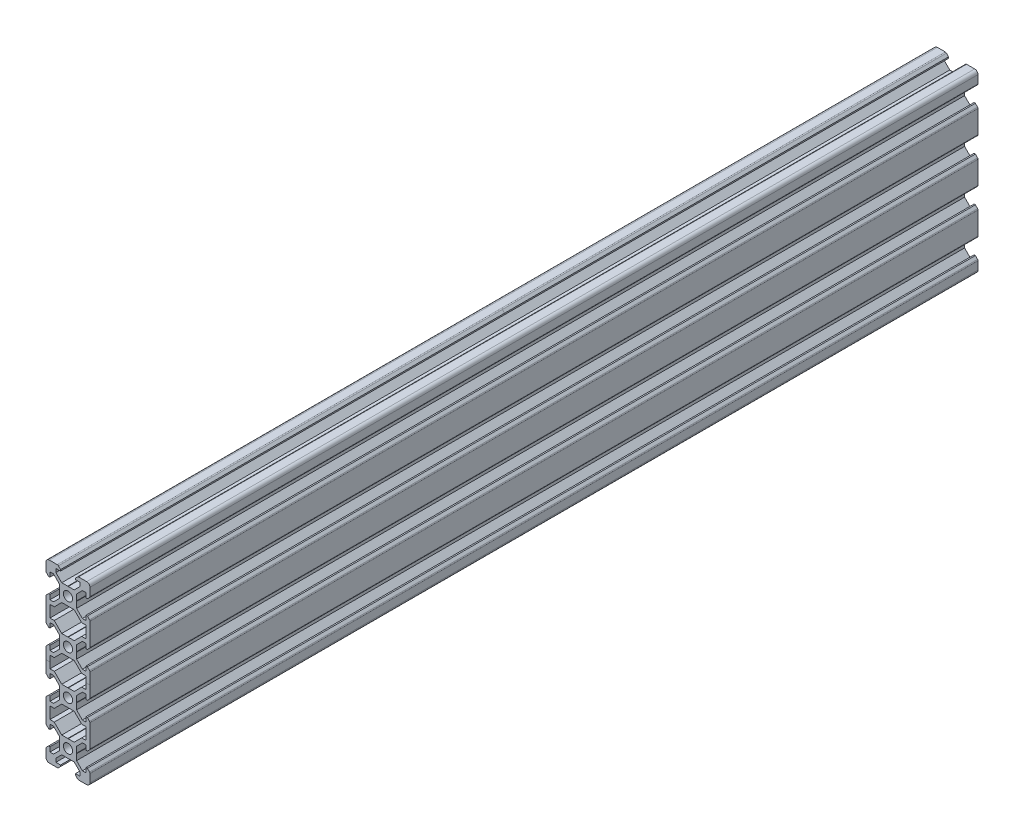
from build123d import *

# Parameters (mm, degrees)
SKETCH1_R           = 2.1
BOSS_EXTRUDE2_DEPTH = 404


with BuildPart() as part:
    # Sketch1 → Boss-Extrude2 (new body)
    with BuildSketch(Plane.XY):
        with BuildLine():
            Line((-8.5, 10), (-4.862792737, 10))
            ThreePointArc((-4.862792737, 10), (-4.598292737, 9.947387679), (-4.374060464, 9.797560464))
            Line((-4.374060464, 9.797560464), (-3.3865, 8.81))
            Line((-3.3865, 8.81), (-3.3865, 8.2))
            Line((-3.3865, 8.2), (-5.5, 8.2))
            Line((-5.5, 8.2), (-5.5, 6.561))
            Line((-5.5, 6.561), (-2.8395, 3.9005))
            Line((-2.8395, 3.9005), (-0.1, 3.9005))
            Line((-0.1, 3.9005), (0, 3.8005))
            Line((0, 3.8005), (0.1, 3.9005))
            Line((0.1, 3.9005), (2.8395, 3.9005))
            Line((2.8395, 3.9005), (5.5, 6.561))
            Line((5.5, 6.561), (5.5, 8.2))
            Line((5.5, 8.2), (3.3865, 8.2))
            Line((3.3865, 8.2), (3.3865, 8.81))
            Line((3.3865, 8.81), (4.374060464, 9.797560464))
            ThreePointArc((4.374060464, 9.797560464), (4.598292737, 9.947387679), (4.862792737, 10))
            Line((4.862792737, 10), (8.5, 10))
            ThreePointArc((8.5, 10), (9.560660172, 9.560660172), (10, 8.5))
            Line((10, 8.5), (10, 4.862792737))
            ThreePointArc((10, 4.862792737), (9.947387679, 4.598292737), (9.797560464, 4.374060464))
            Line((9.797560464, 4.374060464), (8.81, 3.3865))
            Line((8.81, 3.3865), (8.2, 3.3865))
            Line((8.2, 3.3865), (8.2, 5.5))
            Line((8.2, 5.5), (6.561, 5.5))
            Line((6.561, 5.5), (3.9005, 2.8395))
            Line((3.9005, 2.8395), (3.9005, 0.1))
            Line((3.9005, 0.1), (3.8005, 0))
            Line((3.8005, 0), (3.9005, -0.1))
            Line((3.9005, -0.1), (3.9005, -2.8395))
            Line((3.9005, -2.8395), (6.561, -5.5))
            Line((6.561, -5.5), (8.2, -5.5))
            Line((8.2, -5.5), (8.2, -3.3865))
            Line((8.2, -3.3865), (8.81, -3.3865))
            Line((8.81, -3.3865), (9.797560464, -4.374060464))
            ThreePointArc((9.797560464, -4.374060464), (9.947387679, -4.598292737), (10, -4.862792737))
            Line((10, -4.862792737), (10, -15.137207263))
            ThreePointArc((10, -15.137207263), (9.947387679, -15.401707263), (9.797560464, -15.625939536))
            Line((9.797560464, -15.625939536), (8.81, -16.6135))
            Line((8.81, -16.6135), (8.2, -16.6135))
            Line((8.2, -16.6135), (8.2, -14.5))
            Line((8.2, -14.5), (6.561, -14.5))
            Line((6.561, -14.5), (3.9005, -17.1605))
            Line((3.9005, -17.1605), (3.9005, -19.9))
            Line((3.9005, -19.9), (3.8005, -20))
            Line((3.8005, -20), (3.9005, -20.1))
            Line((3.9005, -20.1), (3.9005, -22.8395))
            Line((3.9005, -22.8395), (6.561, -25.5))
            Line((6.561, -25.5), (8.2, -25.5))
            Line((8.2, -25.5), (8.2, -23.3865))
            Line((8.2, -23.3865), (8.81, -23.3865))
            Line((8.81, -23.3865), (9.797560464, -24.374060464))
            ThreePointArc((9.797560464, -24.374060464), (9.947387679, -24.598292737), (10, -24.862792737))
            Line((10, -24.862792737), (10, -35.137207263))
            ThreePointArc((10, -35.137207263), (9.947387679, -35.401707263), (9.797560464, -35.625939536))
            Line((9.797560464, -35.625939536), (8.81, -36.6135))
            Line((8.81, -36.6135), (8.2, -36.6135))
            Line((8.2, -36.6135), (8.2, -34.5))
            Line((8.2, -34.5), (6.561, -34.5))
            Line((6.561, -34.5), (3.9005, -37.1605))
            Line((3.9005, -37.1605), (3.9005, -39.9))
            Line((3.9005, -39.9), (3.8005, -40))
            Line((3.8005, -40), (3.9005, -40.1))
            Line((3.9005, -40.1), (3.9005, -42.8395))
            Line((3.9005, -42.8395), (6.561, -45.5))
            Line((6.561, -45.5), (8.2, -45.5))
            Line((8.2, -45.5), (8.2, -43.3865))
            Line((8.2, -43.3865), (8.81, -43.3865))
            Line((8.81, -43.3865), (9.797560464, -44.374060464))
            ThreePointArc((9.797560464, -44.374060464), (9.947387679, -44.598292737), (10, -44.862792737))
            Line((10, -44.862792737), (10, -55.137207263))
            ThreePointArc((10, -55.137207263), (9.947387679, -55.401707263), (9.797560464, -55.625939536))
            Line((9.797560464, -55.625939536), (8.81, -56.6135))
            Line((8.81, -56.6135), (8.2, -56.6135))
            Line((8.2, -56.6135), (8.2, -54.5))
            Line((8.2, -54.5), (6.561, -54.5))
            Line((6.561, -54.5), (3.9005, -57.1605))
            Line((3.9005, -57.1605), (3.9005, -59.9))
            Line((3.9005, -59.9), (3.8005, -60))
            Line((3.8005, -60), (3.9005, -60.1))
            Line((3.9005, -60.1), (3.9005, -62.8395))
            Line((3.9005, -62.8395), (6.561, -65.5))
            Line((6.561, -65.5), (8.2, -65.5))
            Line((8.2, -65.5), (8.2, -63.3865))
            Line((8.2, -63.3865), (8.81, -63.3865))
            Line((8.81, -63.3865), (9.797560464, -64.374060464))
            ThreePointArc((9.797560464, -64.374060464), (9.947387679, -64.598292737), (10, -64.862792737))
            Line((10, -64.862792737), (10, -68.5))
            ThreePointArc((10, -68.5), (9.560660172, -69.560660172), (8.5, -70))
            Line((8.5, -70), (4.862792737, -70))
            ThreePointArc((4.862792737, -70), (4.598292737, -69.947387679), (4.374060464, -69.797560464))
            Line((4.374060464, -69.797560464), (3.3865, -68.81))
            Line((3.3865, -68.81), (3.3865, -68.2))
            Line((3.3865, -68.2), (5.5, -68.2))
            Line((5.5, -68.2), (5.5, -66.561))
            Line((5.5, -66.561), (2.8395, -63.9005))
            Line((2.8395, -63.9005), (0.1, -63.9005))
            Line((0.1, -63.9005), (0, -63.8005))
            Line((0, -63.8005), (-0.1, -63.9005))
            Line((-0.1, -63.9005), (-2.8395, -63.9005))
            Line((-2.8395, -63.9005), (-5.5, -66.561))
            Line((-5.5, -66.561), (-5.5, -68.2))
            Line((-5.5, -68.2), (-3.3865, -68.2))
            Line((-3.3865, -68.2), (-3.3865, -68.81))
            Line((-3.3865, -68.81), (-4.374060464, -69.797560464))
            ThreePointArc((-4.374060464, -69.797560464), (-4.598292737, -69.947387679), (-4.862792737, -70))
            Line((-4.862792737, -70), (-8.5, -70))
            ThreePointArc((-8.5, -70), (-9.560660172, -69.560660172), (-10, -68.5))
            Line((-10, -68.5), (-10, -64.862792737))
            ThreePointArc((-10, -64.862792737), (-9.947387679, -64.598292737), (-9.797560464, -64.374060464))
            Line((-9.797560464, -64.374060464), (-8.81, -63.3865))
            Line((-8.81, -63.3865), (-8.2, -63.3865))
            Line((-8.2, -63.3865), (-8.2, -65.5))
            Line((-8.2, -65.5), (-6.561, -65.5))
            Line((-6.561, -65.5), (-3.9005, -62.8395))
            Line((-3.9005, -62.8395), (-3.9005, -60.1))
            Line((-3.9005, -60.1), (-3.8005, -60))
            Line((-3.8005, -60), (-3.9005, -59.9))
            Line((-3.9005, -59.9), (-3.9005, -57.1605))
            Line((-3.9005, -57.1605), (-6.561, -54.5))
            Line((-6.561, -54.5), (-8.2, -54.5))
            Line((-8.2, -54.5), (-8.2, -56.6135))
            Line((-8.2, -56.6135), (-8.81, -56.6135))
            Line((-8.81, -56.6135), (-9.797560464, -55.625939536))
            ThreePointArc((-9.797560464, -55.625939536), (-9.947387679, -55.401707263), (-10, -55.137207263))
            Line((-10, -55.137207263), (-10, -44.862792737))
            ThreePointArc((-10, -44.862792737), (-9.947387679, -44.598292737), (-9.797560464, -44.374060464))
            Line((-9.797560464, -44.374060464), (-8.81, -43.3865))
            Line((-8.81, -43.3865), (-8.2, -43.3865))
            Line((-8.2, -43.3865), (-8.2, -45.5))
            Line((-8.2, -45.5), (-6.561, -45.5))
            Line((-6.561, -45.5), (-3.9005, -42.8395))
            Line((-3.9005, -42.8395), (-3.9005, -40.1))
            Line((-3.9005, -40.1), (-3.8005, -40))
            Line((-3.8005, -40), (-3.9005, -39.9))
            Line((-3.9005, -39.9), (-3.9005, -37.1605))
            Line((-3.9005, -37.1605), (-6.561, -34.5))
            Line((-6.561, -34.5), (-8.2, -34.5))
            Line((-8.2, -34.5), (-8.2, -36.6135))
            Line((-8.2, -36.6135), (-8.81, -36.6135))
            Line((-8.81, -36.6135), (-9.797560464, -35.625939536))
            ThreePointArc((-9.797560464, -35.625939536), (-9.947387679, -35.401707263), (-10, -35.137207263))
            Line((-10, -35.137207263), (-10, -24.862792737))
            ThreePointArc((-10, -24.862792737), (-9.947387679, -24.598292737), (-9.797560464, -24.374060464))
            Line((-9.797560464, -24.374060464), (-8.81, -23.3865))
            Line((-8.81, -23.3865), (-8.2, -23.3865))
            Line((-8.2, -23.3865), (-8.2, -25.5))
            Line((-8.2, -25.5), (-6.561, -25.5))
            Line((-6.561, -25.5), (-3.9005, -22.8395))
            Line((-3.9005, -22.8395), (-3.9005, -20.1))
            Line((-3.9005, -20.1), (-3.8005, -20))
            Line((-3.8005, -20), (-3.9005, -19.9))
            Line((-3.9005, -19.9), (-3.9005, -17.1605))
            Line((-3.9005, -17.1605), (-6.561, -14.5))
            Line((-6.561, -14.5), (-8.2, -14.5))
            Line((-8.2, -14.5), (-8.2, -16.6135))
            Line((-8.2, -16.6135), (-8.81, -16.6135))
            Line((-8.81, -16.6135), (-9.797560464, -15.625939536))
            ThreePointArc((-9.797560464, -15.625939536), (-9.947387679, -15.401707263), (-10, -15.137207263))
            Line((-10, -15.137207263), (-10, -4.862792737))
            ThreePointArc((-10, -4.862792737), (-9.947387679, -4.598292737), (-9.797560464, -4.374060464))
            Line((-9.797560464, -4.374060464), (-8.81, -3.3865))
            Line((-8.81, -3.3865), (-8.2, -3.3865))
            Line((-8.2, -3.3865), (-8.2, -5.5))
            Line((-8.2, -5.5), (-6.561, -5.5))
            Line((-6.561, -5.5), (-3.9005, -2.8395))
            Line((-3.9005, -2.8395), (-3.9005, -0.1))
            Line((-3.9005, -0.1), (-3.8005, 0))
            Line((-3.8005, 0), (-3.9005, 0.1))
            Line((-3.9005, 0.1), (-3.9005, 2.8395))
            Line((-3.9005, 2.8395), (-6.561, 5.5))
            Line((-6.561, 5.5), (-8.2, 5.5))
            Line((-8.2, 5.5), (-8.2, 3.3865))
            Line((-8.2, 3.3865), (-8.81, 3.3865))
            Line((-8.81, 3.3865), (-9.797560464, 4.374060464))
            ThreePointArc((-9.797560464, 4.374060464), (-9.947387679, 4.598292737), (-10, 4.862792737))
            Line((-10, 4.862792737), (-10, 8.5))
            ThreePointArc((-10, 8.5), (-9.560660172, 9.560660172), (-8.5, 10))
        make_face()
        Circle(SKETCH1_R, mode=Mode.SUBTRACT)
        with Locations((0, -20)):
            Circle(SKETCH1_R, mode=Mode.SUBTRACT)
        with Locations(Location((0, -40, 0), (0, 0, 180))):
            Circle(SKETCH1_R, mode=Mode.SUBTRACT)
        with Locations(Location((0, -60, 0), (0, 0, 180))):
            Circle(SKETCH1_R, mode=Mode.SUBTRACT)
        Polygon((-8.2, -12.7), (-8.2, -7.3), (-6.239, -7.3), (-5.5, -6.561), (-2.8395, -3.9005), (-0.1, -3.9005), (0, -3.8005), (0.1, -3.9005), (2.8395, -3.9005), (5.5, -6.561), (6.239, -7.3), (8.2, -7.3), (8.2, -12.7), (6.239, -12.7), (5.5, -13.439), (2.8395, -16.0995), (0.1, -16.0995), (0, -16.1995), (-0.1, -16.0995), (-2.8395, -16.0995), (-5.5, -13.439), (-6.239, -12.7), align=None, mode=Mode.SUBTRACT)
        Polygon((2.8395, -23.9005), (5.5, -26.561), (6.239, -27.3), (8.2, -27.3), (8.2, -32.7), (6.239, -32.7), (5.5, -33.439), (2.8395, -36.0995), (0.1, -36.0995), (0, -36.1995), (-0.1, -36.0995), (-2.8395, -36.0995), (-5.5, -33.439), (-6.239, -32.7), (-8.2, -32.7), (-8.2, -27.3), (-6.239, -27.3), (-5.5, -26.561), (-2.8395, -23.9005), (-0.1, -23.9005), (0, -23.8005), (0.1, -23.9005), align=None, mode=Mode.SUBTRACT)
        Polygon((-0.1, -56.0995), (0, -56.1995), (0.1, -56.0995), (2.8395, -56.0995), (5.5, -53.439), (6.239, -52.7), (8.2, -52.7), (8.2, -47.3), (6.239, -47.3), (5.5, -46.561), (2.8395, -43.9005), (0.1, -43.9005), (0, -43.8005), (-0.1, -43.9005), (-2.8395, -43.9005), (-5.5, -46.561), (-6.239, -47.3), (-8.2, -47.3), (-8.2, -52.7), (-6.239, -52.7), (-5.5, -53.439), (-2.8395, -56.0995), align=None, mode=Mode.SUBTRACT)
    extrude(amount=BOSS_EXTRUDE2_DEPTH)


solid = part.part
